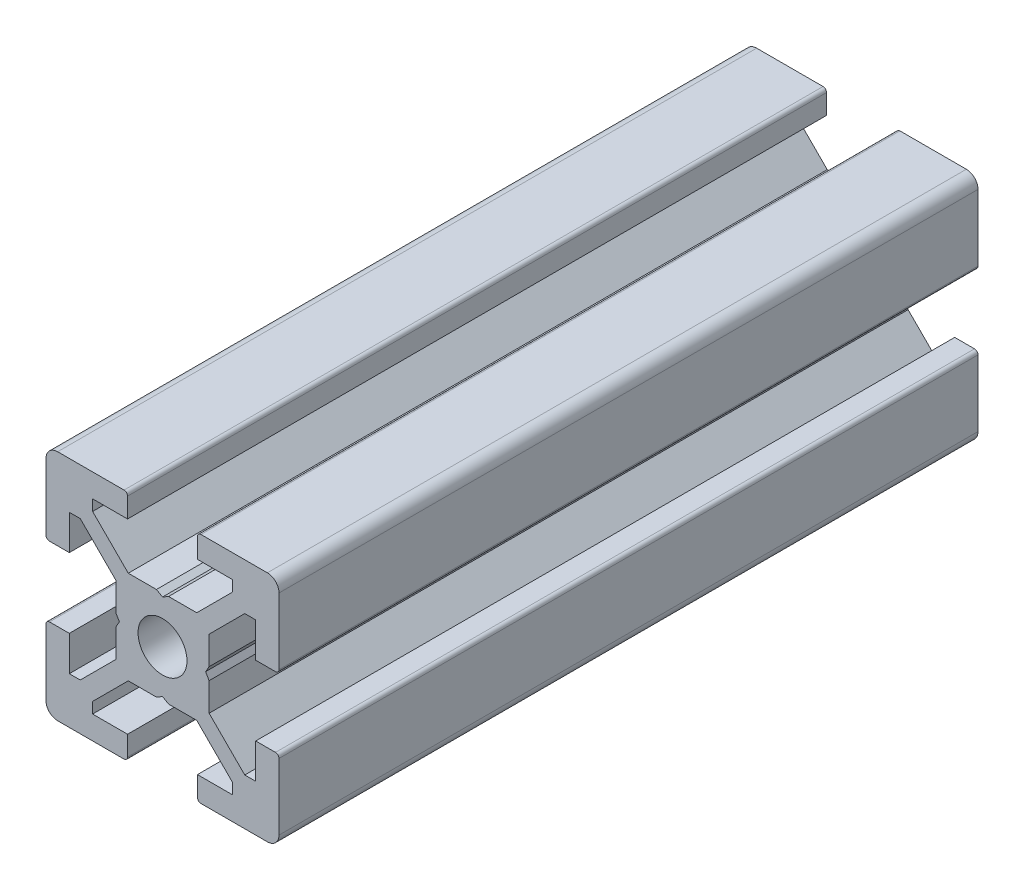
from build123d import *

# Parameters (mm, degrees)
BOSS_EXTRUDE1_DEPTH = 60
SKETCH2_W           = 400
SKETCH2_H           = 2.1


with BuildPart() as part:
    # Sketch1 → Boss-Extrude1 (new body)
    with BuildSketch(Plane.XY):
        with BuildLine():
            Line((-10, 9), (-10, 3.29999995))
            ThreePointArc((-10, 3.29999995), (-9.912132049, 3.087867916), (-9.7, 3))
            Line((-9.7, 3), (-8, 3))
            Line((-8, 3), (-8, 6))
            Line((-8, 6), (-7.060677, 6))
            Line((-7.060677, 6), (-4, 2.93932965))
            Line((-4, 2.93932965), (-4, 0.519615242))
            Line((-4, 0.519615242), (-3.699996283, -6.437e-06))
            Line((-3.699996283, -6.437e-06), (-4, -0.519628117))
            Line((-4, -0.519628117), (-4, -2.93933725))
            Line((-4, -2.93933725), (-7.0606695, -6))
            Line((-7.0606695, -6), (-8, -6))
            Line((-8, -6), (-8, -3))
            Line((-8, -3), (-9.7, -3))
            ThreePointArc((-9.7, -3), (-9.912132049, -3.087867916), (-10, -3.29999995))
            Line((-10, -3.29999995), (-10, -9))
            ThreePointArc((-10, -9), (-9.707106781, -9.707106781), (-9, -10))
            Line((-9, -10), (-3.29999995, -10))
            ThreePointArc((-3.29999995, -10), (-3.087867916, -9.912132049), (-3, -9.7))
            Line((-3, -9.7), (-3, -8))
            Line((-3, -8), (-6, -8))
            Line((-6, -8), (-6, -7.0606515))
            Line((-6, -7.0606515), (-2.9393489, -4))
            Line((-2.9393489, -4), (-0.519615242, -4))
            Line((-0.519615242, -4), (6.437e-06, -3.699996283))
            Line((6.437e-06, -3.699996283), (0.519628117, -4))
            Line((0.519628117, -4), (2.9393227, -4))
            Line((2.9393227, -4), (6, -7.060677))
            Line((6, -7.060677), (6, -8))
            Line((6, -8), (3, -8))
            Line((3, -8), (3, -9.7))
            ThreePointArc((3, -9.7), (3.087867916, -9.912132049), (3.29999995, -10))
            Line((3.29999995, -10), (9, -10))
            ThreePointArc((9, -10), (9.707106781, -9.707106781), (10, -9))
            Line((10, -9), (10, -3.29999995))
            ThreePointArc((10, -3.29999995), (9.912132049, -3.087867916), (9.7, -3))
            Line((9.7, -3), (8, -3))
            Line((8, -3), (8, -6))
            Line((8, -6), (7.0606435, -6))
            Line((7.0606435, -6), (4, -2.9393482))
            Line((4, -2.9393482), (4, -0.519615242))
            Line((4, -0.519615242), (3.699996283, 6.437e-06))
            Line((3.699996283, 6.437e-06), (4, 0.519628117))
            Line((4, 0.519628117), (4, 2.9393401))
            Line((4, 2.9393401), (7.060651, 6))
            Line((7.060651, 6), (8, 6))
            Line((8, 6), (8, 3))
            Line((8, 3), (9.7, 3))
            ThreePointArc((9.7, 3), (9.912132049, 3.087867916), (10, 3.29999995))
            Line((10, 3.29999995), (10, 9))
            ThreePointArc((10, 9), (9.707106781, 9.707106781), (9, 10))
            Line((9, 10), (3.29999995, 10))
            ThreePointArc((3.29999995, 10), (3.087867916, 9.912132049), (3, 9.7))
            Line((3, 9.7), (3, 8))
            Line((3, 8), (6, 8))
            Line((6, 8), (6, 7.060669))
            Line((6, 7.060669), (2.9393308, 4))
            Line((2.9393308, 4), (0.519615242, 4))
            Line((0.519615242, 4), (-6.437e-06, 3.699996283))
            Line((-6.437e-06, 3.699996283), (-0.519628117, 4))
            Line((-0.519628117, 4), (-2.93935655, 4))
            Line((-2.93935655, 4), (-6, 7.0606435))
            Line((-6, 7.0606435), (-6, 8))
            Line((-6, 8), (-3, 8))
            Line((-3, 8), (-3, 9.7))
            ThreePointArc((-3, 9.7), (-3.087867966, 9.912132034), (-3.3, 10))
            Line((-3.3, 10), (-9, 10))
            ThreePointArc((-9, 10), (-9.707106781, 9.707106781), (-10, 9))
        make_face()
    extrude(amount=-BOSS_EXTRUDE1_DEPTH)

    # Sketch2 → Cut-Revolve1 (revolve, cut)
    with BuildSketch(Plane(origin=(0, 0, 0), x_dir=(0, 0, -1), z_dir=(1, 0, 0)), mode=Mode.PRIVATE) as cut_revolve1_sk:
        with Locations((200, 1.05)):
            Rectangle(SKETCH2_W, SKETCH2_H)
    revolve(cut_revolve1_sk.sketch.rotate(Axis((0, 0, -400), (0, 0, 1)), 270), axis=Axis((0, 0, -400), (0, 0, 1)), mode=Mode.SUBTRACT)


solid = part.part
